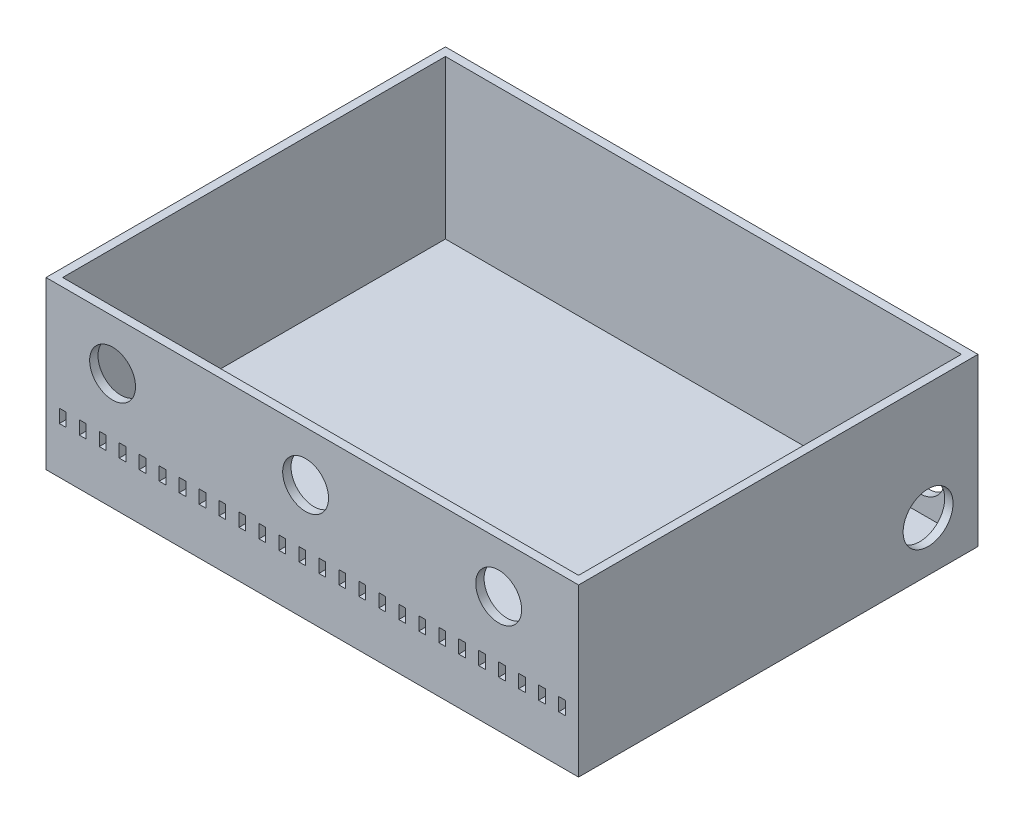
from build123d import *

# Parameters (mm, degrees)
SKETCH1_W           = 203.2
SKETCH1_H           = 152.4
BOSS_EXTRUDE1_DEPTH = 63.5
SKETCH2_W           = 196.85
SKETCH2_H           = 146.05
CUT_EXTRUDE1_DEPTH  = 60.325
SKETCH5_W           = 2.54
SKETCH5_H           = 5.08
CUT_EXTRUDE3_DEPTH  = 47.625
LPATTERN1_COUNT     = 26
LPATTERN1_PITCH     = 7.62
SKETCH6_R           = 8.75
CUT_EXTRUDE4_DEPTH  = 47.625
LPATTERN2_COUNT     = 3
LPATTERN2_PITCH     = 73.66
SKETCH7_R           = 9.525
CUT_EXTRUDE6_DEPTH  = 47.625
SKETCH8_R           = 9.525
CUT_EXTRUDE7_DEPTH  = 47.625


with BuildPart() as part:
    # Sketch1 → Boss-Extrude1 (new body)
    with BuildSketch(Plane(origin=(0, 0, 0), x_dir=(1, 0, 0), z_dir=(0, 1, 0))):
        Rectangle(SKETCH1_W, SKETCH1_H)
    extrude(amount=BOSS_EXTRUDE1_DEPTH)

    # Sketch2 → Cut-Extrude1 (cut)
    with BuildSketch(Plane(origin=(0, 63.5, 0), x_dir=(1, 0, 0), z_dir=(0, 1, 0))):
        Rectangle(SKETCH2_W, SKETCH2_H)
    extrude(amount=-CUT_EXTRUDE1_DEPTH, mode=Mode.SUBTRACT)

    # Sketch5 → Cut-Extrude3 (cut)
    with BuildSketch(Plane.XY.offset(76.2)):
        with Locations((-95.25, 20.32)):
            Rectangle(SKETCH5_W, SKETCH5_H)
    cut_extrude3 = extrude(amount=-CUT_EXTRUDE3_DEPTH, mode=Mode.SUBTRACT)

    # LPattern1: Cut-Extrude3 ×26
    with Locations(*[(i * LPATTERN1_PITCH, 0, 0) for i in range(1, LPATTERN1_COUNT)]):
        add(cut_extrude3, mode=Mode.SUBTRACT)

    # Sketch6 → Cut-Extrude4 (cut)
    with BuildSketch(Plane.XY.offset(76.2)):
        with Locations((-76.2, 44.45)):
            Circle(SKETCH6_R)
    cut_extrude4 = extrude(amount=-CUT_EXTRUDE4_DEPTH, mode=Mode.SUBTRACT)

    # LPattern2: Cut-Extrude4 ×3
    with Locations(*[(i * LPATTERN2_PITCH, 0, 0) for i in range(1, LPATTERN2_COUNT)]):
        add(cut_extrude4, mode=Mode.SUBTRACT)

    # Sketch7 → Cut-Extrude6 (cut)
    with BuildSketch(Plane(origin=(101.6, 0, 0), x_dir=(0, 0, -1), z_dir=(1, 0, 0))):
        with Locations((57.15, 19.05)):
            Circle(SKETCH7_R)
    extrude(amount=-CUT_EXTRUDE6_DEPTH, mode=Mode.SUBTRACT)

    # Sketch8 → Cut-Extrude7 (cut)
    with BuildSketch(Plane(origin=(0, 0, -76.2), x_dir=(-1, 0, 0), z_dir=(0, 0, -1))):
        with Locations((-82.55, 19.05)):
            Circle(SKETCH8_R)
    extrude(amount=-CUT_EXTRUDE7_DEPTH, mode=Mode.SUBTRACT)


solid = part.part
